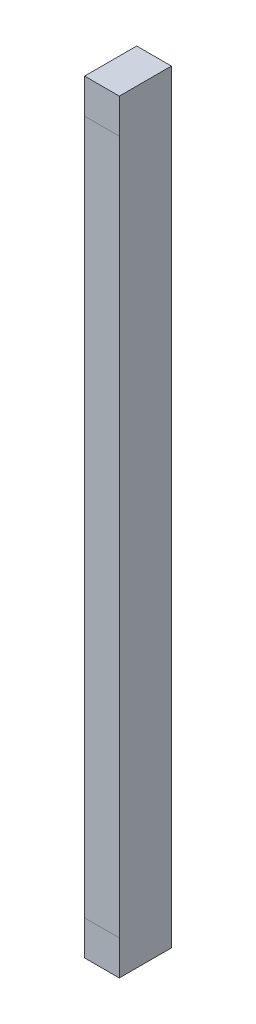
from build123d import *

# Parameters (mm, degrees)
SZKIC1_W                    = 100
SZKIC1_H                    = 150
DODANIE_WYCI_GNI_CIE1_DEPTH = 2200


with BuildPart() as part:
    # Szkic1 → Dodanie-wyciągnięcie1 (new body)
    with BuildSketch(Plane(origin=(0, 0, 0), x_dir=(1, 0, 0), z_dir=(0, 1, 0))):
        with Locations((50, 75)):
            Rectangle(SZKIC1_W, SZKIC1_H)
    extrude(amount=DODANIE_WYCI_GNI_CIE1_DEPTH)


solid = part.part
